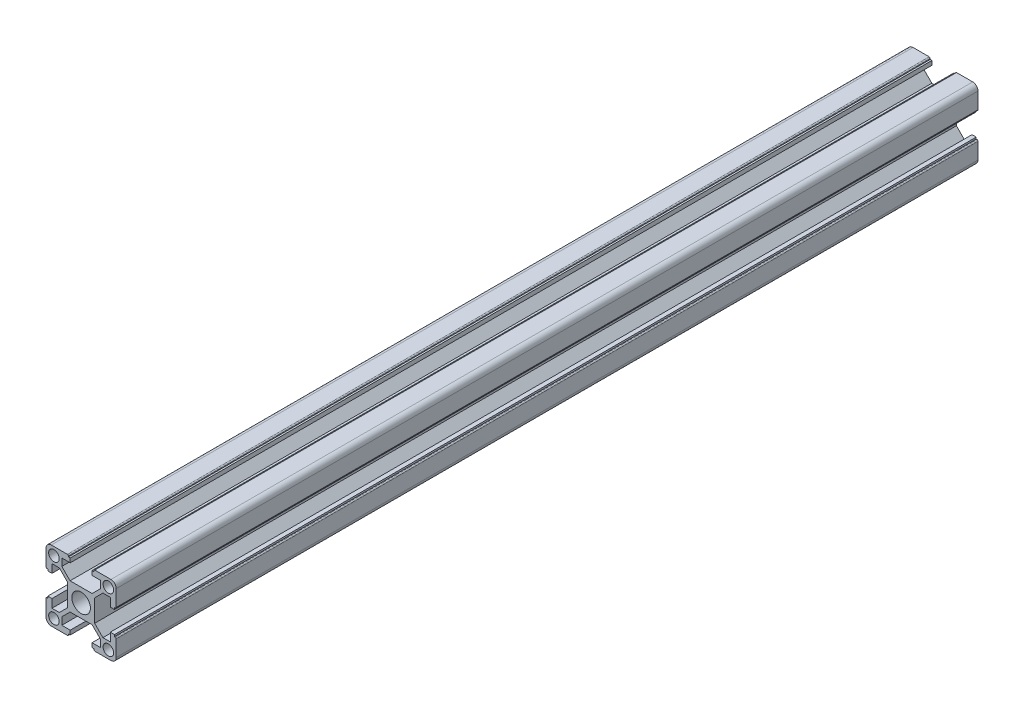
from build123d import *

# Parameters (mm, degrees)
SKETCH_1_R               = 2.65
SKETCH_1_R_2             = 1.5
EXTRUDE_1_DEPTH          = 122.7
CUT_EXTRUDE_1_DEPTH      = 124.512307079
CUT_EXTRUDE_1_DEPTH_BACK = 124.512307079
SKETCH_2_R               = 2.1
SKETCH_3_R               = 4.25
CUT_EXTRUDE_2_DEPTH      = 124.883463483
SKETCH_4_R               = 2.1
CUT_EXTRUDE_3_DEPTH      = 124.883463491


with BuildPart() as part:
    # 草图1 → 凸台-拉伸1 (new, symmetric)
    with BuildSketch(Plane.XY):
        with BuildLine():
            Line((3.142893219, 3.85), (-3.142893219, 3.85))
            Line((-3.142893219, 3.85), (-5.5, 6.207106781))
            Line((-5.5, 6.207106781), (-5.5, 8.3))
            Line((-5.5, 8.3), (-3.1, 8.3))
            Line((-3.1, 8.3), (-3.1, 9.5))
            Line((-3.1, 9.5), (-3.6, 9.5))
            Line((-3.6, 9.5), (-3.6, 9.7))
            ThreePointArc((-3.6, 9.7), (-3.687867966, 9.912132034), (-3.9, 10))
            Line((-3.9, 10), (-8.5, 10))
            ThreePointArc((-8.5, 10), (-9.560660172, 9.560660172), (-10, 8.5))
            Line((-10, 8.5), (-10, 3.9))
            ThreePointArc((-10, 3.9), (-9.912132034, 3.687867966), (-9.7, 3.6))
            Line((-9.7, 3.6), (-9.5, 3.6))
            Line((-9.5, 3.6), (-9.5, 3.1))
            Line((-9.5, 3.1), (-8.3, 3.1))
            Line((-8.3, 3.1), (-8.3, 5.5))
            Line((-8.3, 5.5), (-6.207106781, 5.5))
            Line((-6.207106781, 5.5), (-3.85, 3.142893219))
            Line((-3.85, 3.142893219), (-3.85, -3.142893219))
            Line((-3.85, -3.142893219), (-6.207106781, -5.5))
            Line((-6.207106781, -5.5), (-8.3, -5.5))
            Line((-8.3, -5.5), (-8.3, -3.1))
            Line((-8.3, -3.1), (-9.5, -3.1))
            Line((-9.5, -3.1), (-9.5, -3.6))
            Line((-9.5, -3.6), (-9.7, -3.6))
            ThreePointArc((-9.7, -3.6), (-9.912132034, -3.687867966), (-10, -3.9))
            Line((-10, -3.9), (-10, -8.5))
            ThreePointArc((-10, -8.5), (-9.560660172, -9.560660172), (-8.5, -10))
            Line((-8.5, -10), (-3.9, -10))
            ThreePointArc((-3.9, -10), (-3.687867966, -9.912132034), (-3.6, -9.7))
            Line((-3.6, -9.7), (-3.6, -9.5))
            Line((-3.6, -9.5), (-3.1, -9.5))
            Line((-3.1, -9.5), (-3.1, -8.3))
            Line((-3.1, -8.3), (-5.5, -8.3))
            Line((-5.5, -8.3), (-5.5, -6.207106781))
            Line((-5.5, -6.207106781), (-3.142893219, -3.85))
            Line((-3.142893219, -3.85), (3.142893219, -3.85))
            Line((3.142893219, -3.85), (5.5, -6.207106781))
            Line((5.5, -6.207106781), (5.5, -8.3))
            Line((5.5, -8.3), (3.1, -8.3))
            Line((3.1, -8.3), (3.1, -9.5))
            Line((3.1, -9.5), (3.6, -9.5))
            Line((3.6, -9.5), (3.6, -9.7))
            ThreePointArc((3.6, -9.7), (3.687867966, -9.912132034), (3.9, -10))
            Line((3.9, -10), (8.5, -10))
            ThreePointArc((8.5, -10), (9.560660172, -9.560660172), (10, -8.5))
            Line((10, -8.5), (10, -3.9))
            ThreePointArc((10, -3.9), (9.912132034, -3.687867966), (9.7, -3.6))
            Line((9.7, -3.6), (9.5, -3.6))
            Line((9.5, -3.6), (9.5, -3.1))
            Line((9.5, -3.1), (8.3, -3.1))
            Line((8.3, -3.1), (8.3, -5.5))
            Line((8.3, -5.5), (6.207106781, -5.5))
            Line((6.207106781, -5.5), (3.85, -3.142893219))
            Line((3.85, -3.142893219), (3.85, 3.142893219))
            Line((3.85, 3.142893219), (6.207106781, 5.5))
            Line((6.207106781, 5.5), (8.3, 5.5))
            Line((8.3, 5.5), (8.3, 3.1))
            Line((8.3, 3.1), (9.5, 3.1))
            Line((9.5, 3.1), (9.5, 3.6))
            Line((9.5, 3.6), (9.7, 3.6))
            ThreePointArc((9.7, 3.6), (9.912132034, 3.687867966), (10, 3.9))
            Line((10, 3.9), (10, 8.5))
            ThreePointArc((10, 8.5), (9.560660172, 9.560660172), (8.5, 10))
            Line((8.5, 10), (3.9, 10))
            ThreePointArc((3.9, 10), (3.687867966, 9.912132034), (3.6, 9.7))
            Line((3.6, 9.7), (3.6, 9.5))
            Line((3.6, 9.5), (3.1, 9.5))
            Line((3.1, 9.5), (3.1, 8.3))
            Line((3.1, 8.3), (5.5, 8.3))
            Line((5.5, 8.3), (5.5, 6.207106781))
            Line((5.5, 6.207106781), (3.142893219, 3.85))
        make_face()
        Circle(SKETCH_1_R, mode=Mode.SUBTRACT)
        with Locations((-7.75, 7.75)):
            Circle(SKETCH_1_R_2, mode=Mode.SUBTRACT)
        with Locations((7.75, 7.75)):
            Circle(SKETCH_1_R_2, mode=Mode.SUBTRACT)
        with Locations((7.75, -7.75)):
            Circle(SKETCH_1_R_2, mode=Mode.SUBTRACT)
        with Locations((-7.75, -7.75)):
            Circle(SKETCH_1_R_2, mode=Mode.SUBTRACT)
    extrude(amount=EXTRUDE_1_DEPTH, both=True)

    # 草图2 → 切除-拉伸1 (cut, two sides: drawn at the far end of the back side and taken through both)
    with BuildSketch(Plane(origin=(0, 0, 0), x_dir=(1, 0, 0), z_dir=(0, 1, 0)).offset(-CUT_EXTRUDE_1_DEPTH_BACK)):
        with Locations(Location((0, 112.7, 0), (0, 0, 270))):
            Circle(SKETCH_2_R)
        with Locations(Location((0, 27.3, 0), (0, 0, 270))):
            Circle(SKETCH_2_R)
    extrude(amount=CUT_EXTRUDE_1_DEPTH + CUT_EXTRUDE_1_DEPTH_BACK, mode=Mode.SUBTRACT)

    # 草图3 → 切除-拉伸2 (cut, through all)
    with BuildSketch(Plane.XZ.offset(3.85)):
        with Locations((0, -112.7)):
            Circle(SKETCH_3_R)
        with Locations((0, -27.3)):
            Circle(SKETCH_3_R)
    extrude(amount=CUT_EXTRUDE_2_DEPTH, mode=Mode.SUBTRACT)

    # 草图4 → 切除-拉伸3 (cut, through all)
    with BuildSketch(Plane.ZY.offset(3.85)):
        with Locations((112.7, 0)):
            Circle(SKETCH_4_R)
    extrude(amount=-CUT_EXTRUDE_3_DEPTH, mode=Mode.SUBTRACT)


solid = part.part
